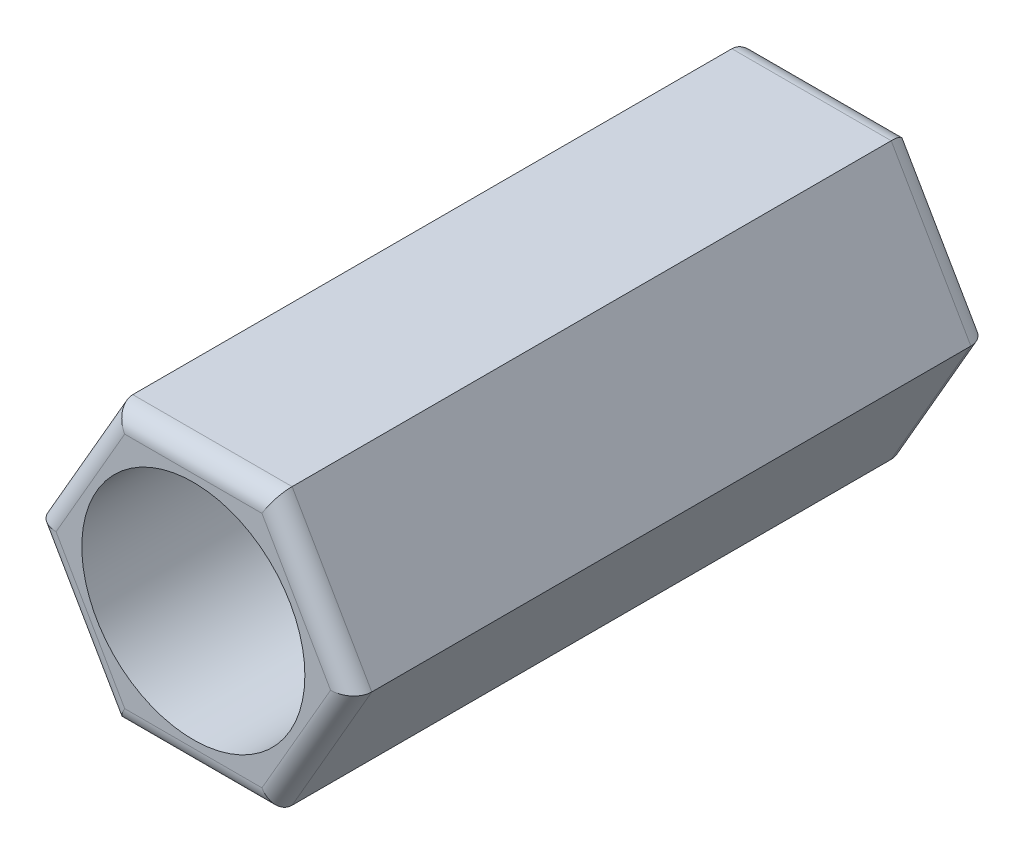
from build123d import *

# Parameters (mm, degrees)
SKETCH1_R           = 1.75
BOSS_EXTRUDE1_DEPTH = 10
FILLET5_R           = 0.3
FILLET6_R           = 0.3


with BuildPart() as part:
    # Sketch1 → Boss-Extrude1 (new body)
    with BuildSketch(Plane.XY):
        Polygon((2.5, 0), (1.25, 2.165063509), (-1.25, 2.165063509), (-2.5, 0), (-1.25, -2.165063509), (1.25, -2.165063509), align=None)
        Circle(SKETCH1_R, mode=Mode.SUBTRACT)
    extrude(amount=BOSS_EXTRUDE1_DEPTH)

    # Fillet5
    fillet5_edges = [part.edges().sort_by_distance(p)[0] for p in [
        (0, 2.165063509, 10),
        (-1.875, 1.082531755, 10),
        (-1.875, -1.082531755, 10),
        (0, -2.165063509, 10),
        (1.875, -1.082531755, 10),
        (1.875, 1.082531755, 10),
    ]]
    fillet(fillet5_edges, radius=FILLET5_R)

    # Fillet6
    fillet6_edges = [part.edges().sort_by_distance(p)[0] for p in [
        (0, -2.165063509, 0),
        (-1.875, -1.082531755, 0),
        (-1.875, 1.082531755, 0),
        (0, 2.165063509, 0),
        (1.875, 1.082531755, 0),
        (1.875, -1.082531755, 0),
    ]]
    fillet(fillet6_edges, radius=FILLET6_R)


solid = part.part
